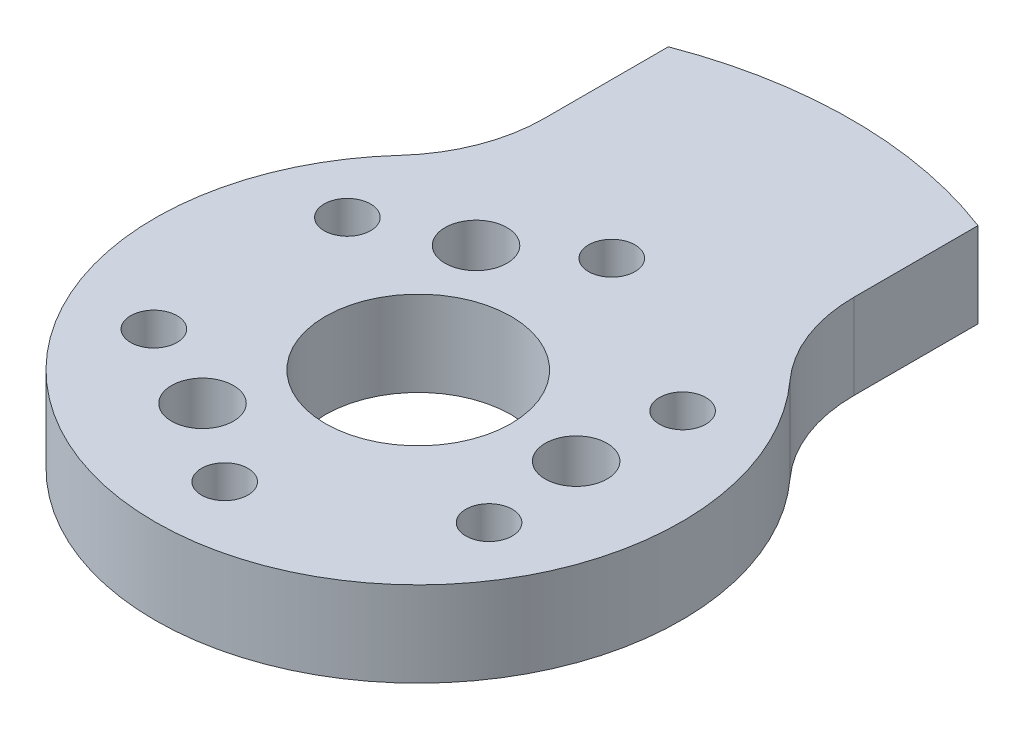
from build123d import *

# Parameters (mm, degrees)
SKETCH_1_R      = 2
SKETCH_1_R_2    = 1.5
SKETCH_1_R_3    = 6
EXTRUDE_1_DEPTH = 5.5
FILLET_1_R      = 10


with BuildPart() as part:
    # 草图1 → 凸台-拉伸1 (new body)
    with BuildSketch(Plane(origin=(0, 0, 0), x_dir=(1, 0, 0), z_dir=(0, 1, 0))):
        with BuildLine():
            Line((-10, 26.153393661), (-10, 13.747727085))
            ThreePointArc((-10, 13.747727085), (0, -17), (10, 13.747727085))
            Line((10, 13.747727085), (10, 26.153393661))
            ThreePointArc((10, 26.153393661), (0, 28), (-10, 26.153393661))
        make_face()
        with Locations(Location((-5.1, 8.833459119, 0), (0, 0, 270))):
            Circle(SKETCH_1_R, mode=Mode.SUBTRACT)
        with Locations(Location((-10.825317547, 6.25, 0), (0, 0, 270))):
            Circle(SKETCH_1_R_2, mode=Mode.SUBTRACT)
        with Locations(Location((10.2, 0, 0), (0, 0, 270))):
            Circle(SKETCH_1_R, mode=Mode.SUBTRACT)
        with Locations(Location((-5.1, -8.833459119, 0), (0, 0, 270))):
            Circle(SKETCH_1_R, mode=Mode.SUBTRACT)
        with Locations(Location((0, 12.5, 0), (0, 0, 270))):
            Circle(SKETCH_1_R_2, mode=Mode.SUBTRACT)
        with Locations(Location((10.825317547, 6.25, 0), (0, 0, 270))):
            Circle(SKETCH_1_R_2, mode=Mode.SUBTRACT)
        with Locations(Location((10.825317547, -6.25, 0), (0, 0, 270))):
            Circle(SKETCH_1_R_2, mode=Mode.SUBTRACT)
        with Locations(Location((0, -12.5, 0), (0, 0, 270))):
            Circle(SKETCH_1_R_2, mode=Mode.SUBTRACT)
        with Locations(Location((-10.825317547, -6.25, 0), (0, 0, 270))):
            Circle(SKETCH_1_R_2, mode=Mode.SUBTRACT)
        with Locations(Location((0, 0, 0), (0, 0, 270))):
            Circle(SKETCH_1_R_3, mode=Mode.SUBTRACT)
    extrude(amount=EXTRUDE_1_DEPTH)

    # 圆角1
    fillet_1_edges = [part.edges().sort_by_distance(p)[0] for p in [
        (10, 2.75, -13.747727085),
        (-10, 2.75, -13.747727085),
    ]]
    fillet(fillet_1_edges, radius=FILLET_1_R)


solid = part.part
